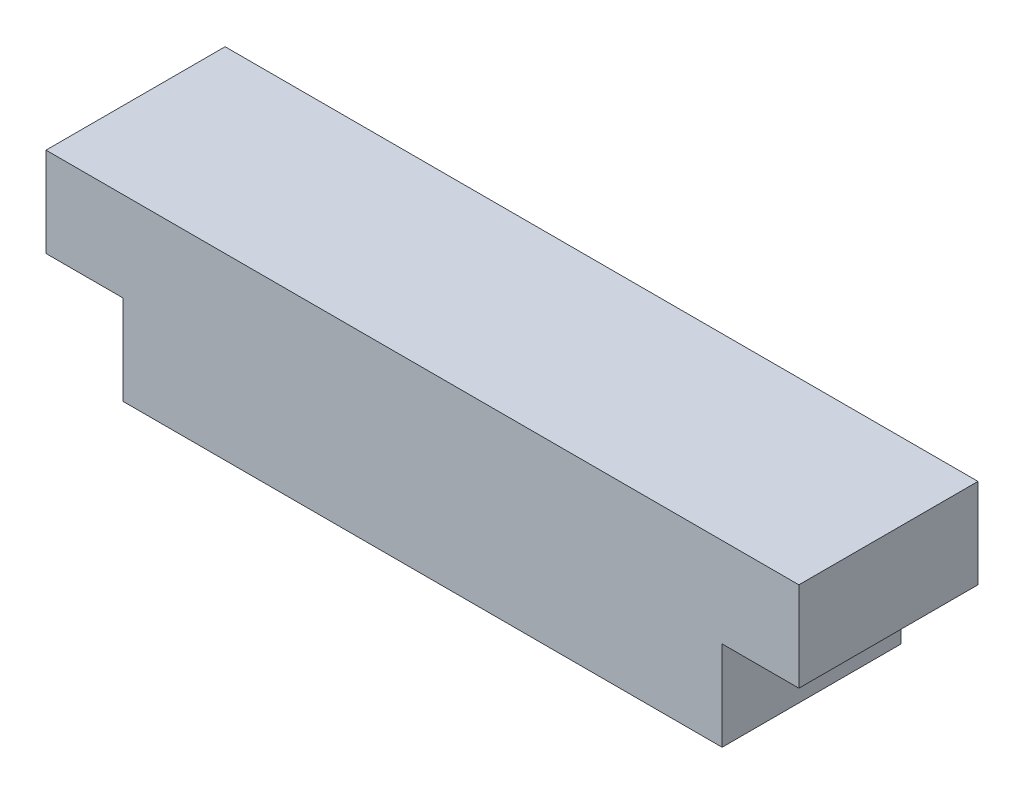
from build123d import *

# Parameters (mm, degrees)
SKETCH1_W           = 42.5
SKETCH1_H           = 6.35
BOSS_EXTRUDE1_DEPTH = 12.7
SKETCH2_W           = 53.3875
SKETCH2_H           = 6.35
BOSS_EXTRUDE2_DEPTH = 12.7


with BuildPart() as part:
    # Sketch1 → Boss-Extrude1 (new body)
    with BuildSketch(Plane.XY):
        Rectangle(SKETCH1_W, SKETCH1_H)
    extrude(amount=BOSS_EXTRUDE1_DEPTH)

    # Sketch2 → Boss-Extrude2 (add)
    with BuildSketch(Plane.XY.offset(12.7)):
        with Locations((0, 6.35)):
            Rectangle(SKETCH2_W, SKETCH2_H)
    extrude(amount=-BOSS_EXTRUDE2_DEPTH)


solid = part.part
